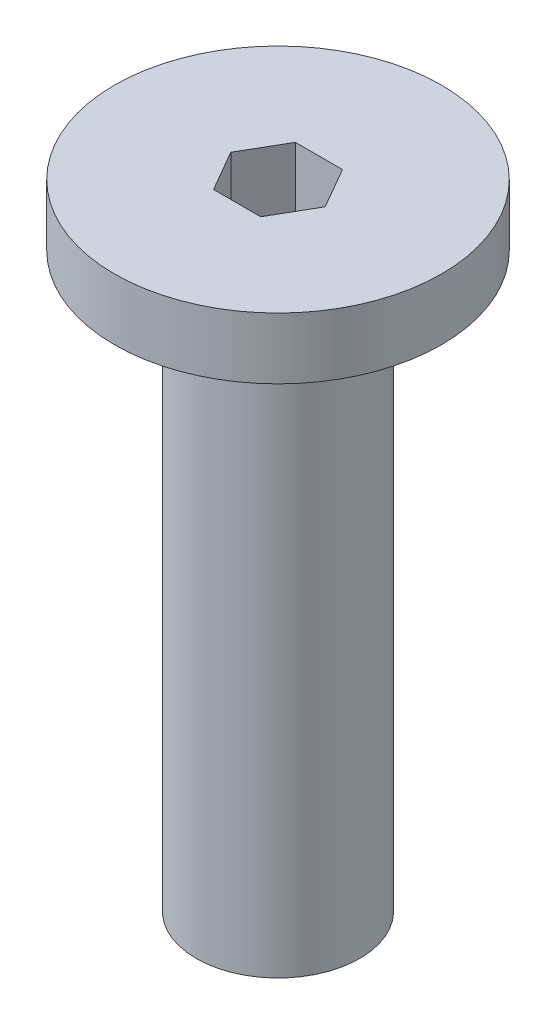
from build123d import *

# Parameters (mm, degrees)
CUT_EXTRUDE1_DEPTH = 2.5


with BuildPart() as part:
    # Sketch1 → Revolve1 (revolve)
    with BuildSketch(Plane.XY, mode=Mode.PRIVATE) as revolve1_sk:
        Polygon((0, -14), (2, -14), (2, 0), (4, 0), (4, 1.5), (0, 1.5), align=None)
    revolve(revolve1_sk.sketch.rotate(Axis((0, 61.691642626, 0), (0, -1, 0)), 90), axis=Axis((0, 61.691642626, 0), (0, -1, 0)))

    # Sketch2 → Cut-Extrude1 (cut)
    with BuildSketch(Plane(origin=(0, 1.5, 0), x_dir=(-1, 0, 0), z_dir=(0, 1, 0))):
        Polygon((-0.577350269, -1), (0.577350269, -1), (1.154700538, 0), (0.577350269, 1), (-0.577350269, 1), (-1.154700538, 0), align=None)
    extrude(amount=-CUT_EXTRUDE1_DEPTH, mode=Mode.SUBTRACT)


solid = part.part
